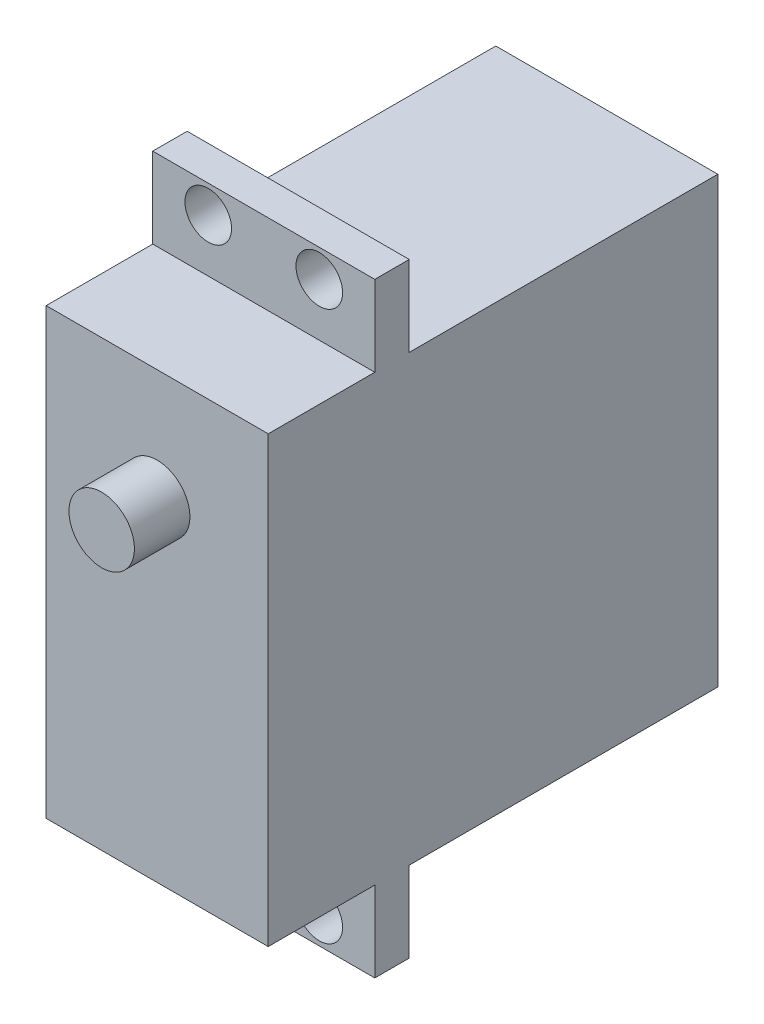
from build123d import *

# Parameters (mm, degrees)
SKETCH1_W           = 40
SKETCH1_H           = 40.5
BOSS_EXTRUDE1_DEPTH = 10
SKETCH2_W           = 20
SKETCH2_H           = 3.1
BOSS_EXTRUDE2_DEPTH = 7.25
SKETCH3_R           = 2.1
CUT_EXTRUDE1_DEPTH  = 43.395430178
SKETCH5_R           = 2.95
BOSS_EXTRUDE3_DEPTH = 5


with BuildPart() as part:
    # Sketch1 → Boss-Extrude1 (new, symmetric)
    with BuildSketch(Plane.YZ):
        Rectangle(SKETCH1_W, SKETCH1_H)
    extrude(amount=BOSS_EXTRUDE1_DEPTH, both=True)

    # Sketch2 → Boss-Extrude2 (add)
    with BuildSketch(Plane.XZ.offset(20)):
        with Locations((0, 9.1)):
            Rectangle(SKETCH2_W, SKETCH2_H)
    boss_extrude2 = extrude(amount=BOSS_EXTRUDE2_DEPTH)

    # Sketch3 → Cut-Extrude1 (cut, through all)
    with BuildSketch(Plane.XY.offset(10.65)):
        with Locations((-5, -24.75)):
            Circle(SKETCH3_R)
        with Locations((5, -24.75)):
            Circle(SKETCH3_R)
    cut_extrude1 = extrude(amount=-CUT_EXTRUDE1_DEPTH, mode=Mode.SUBTRACT)

    # Mirror1: Boss-Extrude2, Cut-Extrude1 across plane
    add(boss_extrude2.mirror(Plane.ZX))
    add(cut_extrude1.mirror(Plane.ZX), mode=Mode.SUBTRACT)

    # Sketch5 → Boss-Extrude3 (add)
    with BuildSketch(Plane.XY.offset(20.25)):
        with Locations((0, 10)):
            Circle(SKETCH5_R)
    extrude(amount=BOSS_EXTRUDE3_DEPTH)


solid = part.part
